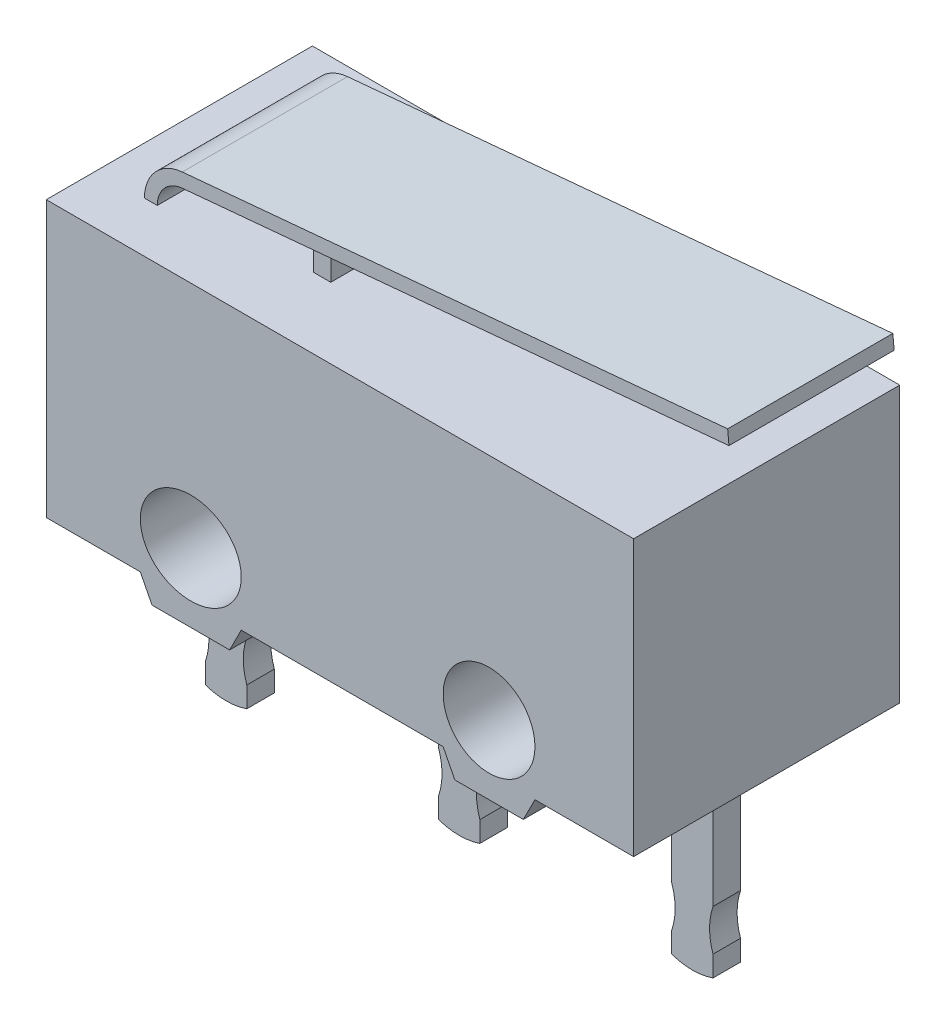
from build123d import *

# Parameters (mm, degrees)
SKETCH1_R               = 1
BOSS_EXTRUDE1_DEPTH     = 2.9
BOSS_EXTRUDE2_DEPTH     = 1.8
BOSS_EXTRUDE3_DEPTH     = 1.3589
SKETCH1_5_W             = 0.9
SKETCH1_5_H             = 4.1
BOSS_EXTRUDE4_DEPTH     = 0.3
BOSS_EXTRUDE4_2_DEPTH   = 0.3
BOSS_EXTRUDE4_3_DEPTH   = 0.3
CUT_EXTRUDE4_DEPTH      = 11.476981306
CUT_EXTRUDE4_DEPTH_BACK = 11.476981306
CUT_EXTRUDE5_DEPTH      = 11.476981306
CUT_EXTRUDE5_DEPTH_BACK = 11.476981306
CUT_EXTRUDE6_DEPTH      = 11.476981306
CUT_EXTRUDE6_DEPTH_BACK = 11.476981306
BOSS_EXTRUDE5_START     = -0.3
BOSS_EXTRUDE5_DEPTH     = 0.6


with BuildPart() as part:
    # Sketch1 → Boss-Extrude1 (new, symmetric)
    with BuildSketch(Plane.XY):
        Polygon((-2.15, -2.75), (2.25, -2.75), (2.50390625, -3.25), (3.99609375, -3.25), (4.25, -2.75), (6.4, -2.75), (6.4, 3.25), (-6.4, 3.25), (-6.4, -2.75), (-4.35, -2.75), (-4.09609375, -3.25), (-2.40390625, -3.25), align=None)
        with BuildLine():
            add(Edge.make_bspline(
                [(-3.25, -2.75), (-2.15, -2.75), (-2.15, -1.75)],
                knots=[4.71238898, 4.71238898, 4.71238898, 6.283185307, 6.283185307, 6.283185307], degree=2, weights=[1, 0.707106781, 1]))
            add(Edge.make_bspline(
                [(-2.15, -1.75), (-2.15, 0.664213562), (-4.027817459, -1.042893219), (-5.905634919, -2.75), (-3.25, -2.75)],
                knots=[0, 0, 0, 2.35619449, 2.35619449, 4.71238898, 4.71238898, 4.71238898], degree=2, weights=[1, 0.382683432, 1, 0.382683432, 1]))
        make_face(mode=Mode.SUBTRACT)
        with Locations((3.25, -1.75)):
            Circle(SKETCH1_R, mode=Mode.SUBTRACT)
    extrude(amount=BOSS_EXTRUDE1_DEPTH, both=True)

    # Sketch1<3> → Boss-Extrude2 (add, symmetric)
    with BuildSketch(Plane.XY):
        with BuildLine():
            ThreePointArc((-4.535551444, 4.15417696), (-5.12307576, 3.861878504), (-5.3602, 3.25))
            Line((-5.3602, 3.25), (-5.081030172, 3.25))
            ThreePointArc((-5.081030172, 3.25), (-4.924180047, 3.654738123), (-4.535551444, 3.848084232))
            Line((-4.535551444, 3.848084232), (7.37798324, 4.946487268))
            Line((7.37798324, 4.946487268), (7.35, 5.25))
            Line((7.35, 5.25), (-4.535551444, 4.15417696))
        make_face()
    extrude(amount=BOSS_EXTRUDE2_DEPTH, both=True)

    # Sketch1<4> → Boss-Extrude3 (add, symmetric)
    with BuildSketch(Plane.XY):
        with BuildLine():
            Line((-2.1217, 3.885), (-2.1217, 3.25))
            Line((-2.1217, 3.25), (-1.7407, 3.25))
            Line((-1.7407, 3.25), (-1.7407, 3.885))
            ThreePointArc((-1.7407, 3.885), (-1.9312, 4.0755), (-2.1217, 3.885))
        make_face()
    extrude(amount=BOSS_EXTRUDE3_DEPTH, both=True)



with BuildPart() as body_2:
    # Sketch1<5> → Boss-Extrude4 (new, symmetric)
    with BuildSketch(Plane.XY):
        with Locations((-5.08, -4.8)):
            Rectangle(SKETCH1_5_W, SKETCH1_5_H)
    extrude(amount=BOSS_EXTRUDE4_DEPTH, both=True)

    # Sketch2<4> → Cut-Extrude5 (cut, two sides: drawn at the far end of the back side and taken through both)
    with BuildSketch(Plane.XY.offset(-CUT_EXTRUDE5_DEPTH_BACK)):
        with BuildLine():
            ThreePointArc((-4.63, -5.4250018), (-4.705, -5.8750009), (-4.63, -6.325))
            Line((-4.63, -6.325), (-4.63, -5.4250018))
        make_face()
        with BuildLine():
            Line((-5.08, -6.85), (-4.63, -6.85))
            Line((-4.63, -6.85), (-4.63, -6.775))
            ThreePointArc((-4.63, -6.775), (-4.851896405, -6.831121569), (-5.08, -6.85))
        make_face()
        with BuildLine():
            Line((-5.53, -6.85), (-5.08, -6.85))
            ThreePointArc((-5.08, -6.85), (-5.308103595, -6.831121569), (-5.53, -6.775))
            Line((-5.53, -6.775), (-5.53, -6.85))
        make_face()
        with BuildLine():
            Line((-5.53, -5.4250018), (-5.53, -6.325))
            ThreePointArc((-5.53, -6.325), (-5.455, -5.8750009), (-5.53, -5.4250018))
        make_face()
    extrude(amount=CUT_EXTRUDE5_DEPTH + CUT_EXTRUDE5_DEPTH_BACK, mode=Mode.SUBTRACT)


with BuildPart() as body_3:
    # Sketch1<5> → Boss-Extrude4 2 (new, symmetric)
    with BuildSketch(Plane.XY):
        with Locations((0, -4.8)):
            Rectangle(SKETCH1_5_W, SKETCH1_5_H)
    extrude(amount=BOSS_EXTRUDE4_2_DEPTH, both=True)

    # Sketch2 → Cut-Extrude4 (cut, two sides: drawn at the far end of the back side and taken through both)
    with BuildSketch(Plane.XY.offset(-CUT_EXTRUDE4_DEPTH_BACK)):
        with BuildLine():
            ThreePointArc((5.53, -5.4250018), (5.455, -5.8750009), (5.53, -6.325))
            Line((5.53, -6.325), (5.53, -5.4250018))
        make_face()
        with BuildLine():
            Line((4.63, -5.4250018), (4.63, -6.325))
            ThreePointArc((4.63, -6.325), (4.705, -5.8750009), (4.63, -5.4250018))
        make_face()
        with BuildLine():
            ThreePointArc((5.53, -6.775), (5.308103595, -6.831121569), (5.08, -6.85))
            Line((5.08, -6.85), (5.53, -6.85))
            Line((5.53, -6.85), (5.53, -6.775))
        make_face()
        with BuildLine():
            Line((4.63, -6.775), (4.63, -6.85))
            Line((4.63, -6.85), (5.08, -6.85))
            ThreePointArc((5.08, -6.85), (4.851896405, -6.831121569), (4.63, -6.775))
        make_face()
        with BuildLine():
            ThreePointArc((0.45, -5.4250018), (0.375, -5.8750009), (0.45, -6.325))
            Line((0.45, -6.325), (0.45, -5.4250018))
        make_face()
        with BuildLine():
            Line((-0.45, -5.4250018), (-0.45, -6.325))
            ThreePointArc((-0.45, -6.325), (-0.375, -5.8750009), (-0.45, -5.4250018))
        make_face()
        with BuildLine():
            Line((-0.45, -6.85), (0, -6.85))
            ThreePointArc((0, -6.85), (-0.228103595, -6.831121569), (-0.45, -6.775))
            Line((-0.45, -6.775), (-0.45, -6.85))
        make_face()
        with BuildLine():
            Line((0, -6.85), (0.45, -6.85))
            Line((0.45, -6.85), (0.45, -6.775))
            ThreePointArc((0.45, -6.775), (0.228103595, -6.831121569), (0, -6.85))
        make_face()
        with BuildLine():
            ThreePointArc((-4.63, -5.4250018), (-4.705, -5.8750009), (-4.63, -6.325))
            Line((-4.63, -6.325), (-4.63, -5.4250018))
        make_face()
        with BuildLine():
            Line((-5.08, -6.85), (-4.63, -6.85))
            Line((-4.63, -6.85), (-4.63, -6.775))
            ThreePointArc((-4.63, -6.775), (-4.851896405, -6.831121569), (-5.08, -6.85))
        make_face()
        with BuildLine():
            Line((-5.53, -6.85), (-5.08, -6.85))
            ThreePointArc((-5.08, -6.85), (-5.308103595, -6.831121569), (-5.53, -6.775))
            Line((-5.53, -6.775), (-5.53, -6.85))
        make_face()
        with BuildLine():
            Line((-5.53, -5.4250018), (-5.53, -6.325))
            ThreePointArc((-5.53, -6.325), (-5.455, -5.8750009), (-5.53, -5.4250018))
        make_face()
    extrude(amount=CUT_EXTRUDE4_DEPTH + CUT_EXTRUDE4_DEPTH_BACK, mode=Mode.SUBTRACT)


with BuildPart() as body_4:
    # Sketch1<5> → Boss-Extrude4 3 (new, symmetric)
    with BuildSketch(Plane.XY):
        with Locations((5.08, -4.8)):
            Rectangle(SKETCH1_5_W, SKETCH1_5_H)
    extrude(amount=BOSS_EXTRUDE4_3_DEPTH, both=True)

    # Sketch2<5> → Cut-Extrude6 (cut, two sides: drawn at the far end of the back side and taken through both)
    with BuildSketch(Plane.XY.offset(-CUT_EXTRUDE6_DEPTH_BACK)):
        with BuildLine():
            Line((4.63, -5.4250018), (4.63, -6.325))
            ThreePointArc((4.63, -6.325), (4.705, -5.8750009), (4.63, -5.4250018))
        make_face()
        with BuildLine():
            ThreePointArc((5.53, -5.4250018), (5.455, -5.8750009), (5.53, -6.325))
            Line((5.53, -6.325), (5.53, -5.4250018))
        make_face()
        with BuildLine():
            ThreePointArc((5.53, -6.775), (5.308103595, -6.831121569), (5.08, -6.85))
            Line((5.08, -6.85), (5.53, -6.85))
            Line((5.53, -6.85), (5.53, -6.775))
        make_face()
        with BuildLine():
            Line((4.63, -6.775), (4.63, -6.85))
            Line((4.63, -6.85), (5.08, -6.85))
            ThreePointArc((5.08, -6.85), (4.851896405, -6.831121569), (4.63, -6.775))
        make_face()
    extrude(amount=CUT_EXTRUDE6_DEPTH + CUT_EXTRUDE6_DEPTH_BACK, mode=Mode.SUBTRACT)


with BuildPart() as part_1:
    add(part.part)

    add(body_2.part)  # Boss-Extrude5 merges body 2

    add(body_3.part)  # Boss-Extrude5 merges body 3

    add(body_4.part)  # Boss-Extrude5 merges body 4
    # Sketch2<7> → Boss-Extrude5 (add)
    with BuildSketch(Plane.XY.offset(BOSS_EXTRUDE5_START)):
        Polygon((4.44, -3), (4.63, -3.19), (4.63, -2.75), (4.44, -2.75), align=None)
        Polygon((0.45, -2.75), (0.45, -3.19), (0.64, -3), (0.64, -2.75), align=None)
        Polygon((-4.63, -2.75), (-4.63, -3.19), (-4.44, -3), (-4.44, -2.75), align=None)
    extrude(amount=BOSS_EXTRUDE5_DEPTH)


solid = part_1.part
